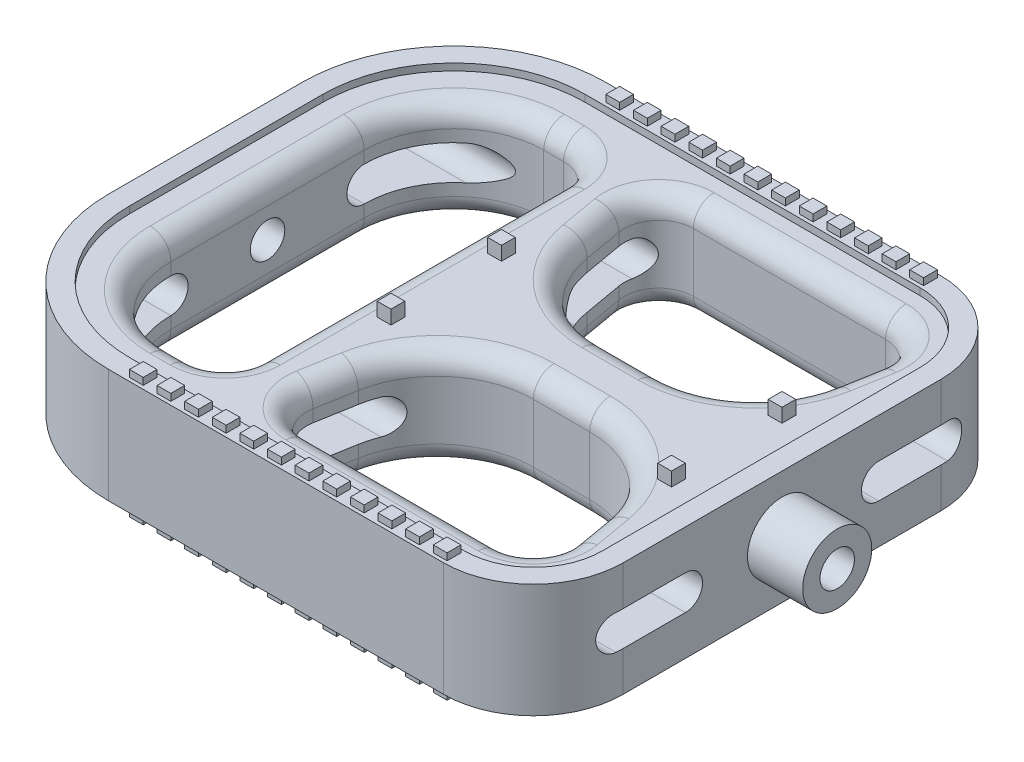
from build123d import *

# Parameters (mm, degrees)
BOSS_EXTRUDE5_DEPTH     = 16.5
BOSS_EXTRUDE1_START     = 1
BOSS_EXTRUDE1_DEPTH     = 14.5
CUT_EXTRUDE1_DEPTH      = 93.41482565
CUT_EXTRUDE1_DEPTH_BACK = 93.41482565
SKETCH2_R               = 2.5
BOSS_EXTRUDE3_START     = 8
SKETCH2_3_R             = 5
SKETCH2_3_R_2           = 2.5
BOSS_EXTRUDE3_DEPTH     = 8
FILLET3_R               = 3
BOSS_EXTRUDE4_START     = -16.5
SKETCH3_W               = 2
SKETCH3_H               = 2
BOSS_EXTRUDE4_DEPTH     = 18.5


with BuildPart() as part:
    # Sketch1<4> → Boss-Extrude5 (new body)
    with BuildSketch(Plane(origin=(0, 0, 0), x_dir=(1, 0, 0), z_dir=(0, 1, 0))):
        with BuildLine():
            Line((-83.5, -14), (-83.5, 14))
            ThreePointArc((-83.5, 14), (-77.056349186, 29.556349186), (-61.5, 36))
            Line((-61.5, 36), (-13, 36))
            ThreePointArc((-13, 36), (-3.807611845, 32.192388155), (0, 23))
            Line((0, 23), (0, -23))
            ThreePointArc((0, -23), (-3.807611845, -32.192388155), (-13, -36))
            Line((-13, -36), (-61.5, -36))
            ThreePointArc((-61.5, -36), (-77.056349186, -29.556349186), (-83.5, -14))
        make_face()
        with BuildLine():
            ThreePointArc((-80.5, -14), (-74.935028843, -27.435028843), (-61.5, -33))
            Line((-61.5, -33), (-13, -33))
            ThreePointArc((-13, -33), (-5.928932188, -30.071067812), (-3, -23))
            Line((-3, -23), (-3, 23))
            ThreePointArc((-3, 23), (-5.928932188, 30.071067812), (-13, 33))
            Line((-13, 33), (-61.5, 33))
            ThreePointArc((-61.5, 33), (-74.935028843, 27.435028843), (-80.5, 14))
            Line((-80.5, 14), (-80.5, -14))
        make_face(mode=Mode.SUBTRACT)
    extrude(amount=BOSS_EXTRUDE5_DEPTH)

    # Sketch1 → Boss-Extrude1 (add)
    # profile 1 of 2: a face of its own
    with BuildSketch(Plane(origin=(0, 0, 0), x_dir=(1, 0, 0), z_dir=(0, 1, 0)).offset(BOSS_EXTRUDE1_START)):
        with BuildLine():
            Line((-3, -23), (-3, 0))
            Line((-3, 0), (-53.625, 0))
            Line((-53.625, 0), (-53.625, -22))
            ThreePointArc((-53.625, -22), (-55.089466094, -25.535533906), (-58.625, -27))
            Line((-58.625, -27), (-61.5, -27))
            ThreePointArc((-61.5, -27), (-70.692388155, -23.192388155), (-74.5, -14))
            Line((-74.5, -14), (-74.5, 0))
            Line((-74.5, 0), (-80.5, 0))
            Line((-80.5, 0), (-80.5, -14))
            ThreePointArc((-80.5, -14), (-74.935028843, -27.435028843), (-61.5, -33))
            Line((-61.5, -33), (-13, -33))
            ThreePointArc((-13, -33), (-5.928932188, -30.071067812), (-3, -23))
        make_face()
        with BuildLine():
            Line((-45.757372098, -22.131759112), (-44.776494446, -16.568925513))
            ThreePointArc((-44.776494446, -16.568925513), (-39.988212439, -8.275377796), (-30.989185904, -5))
            Line((-30.989185904, -5), (-22.84414743, -5))
            ThreePointArc((-22.84414743, -5), (-13.845120894, -8.275377796), (-9.056838888, -16.568925513))
            Line((-9.056838888, -16.568925513), (-8.075961235, -22.131759112))
            ThreePointArc((-8.075961235, -22.131759112), (-9.169777784, -26.213938048), (-13, -28))
            Line((-13, -28), (-40.833333333, -28))
            ThreePointArc((-40.833333333, -28), (-44.663555549, -26.213938048), (-45.757372098, -22.131759112))
        make_face(mode=Mode.SUBTRACT)
    # profile 2 of 2: a face of its own
    with BuildSketch(Plane(origin=(0, 0, 0), x_dir=(1, 0, 0), z_dir=(0, 1, 0)).offset(BOSS_EXTRUDE1_START)):
        with BuildLine():
            Line((-53.625, 0), (-3, 0))
            Line((-3, 0), (-3, 23))
            ThreePointArc((-3, 23), (-5.928932188, 30.071067812), (-13, 33))
            Line((-13, 33), (-61.5, 33))
            ThreePointArc((-61.5, 33), (-74.935028843, 27.435028843), (-80.5, 14))
            Line((-80.5, 14), (-80.5, 0))
            Line((-80.5, 0), (-74.5, 0))
            Line((-74.5, 0), (-74.5, 14))
            ThreePointArc((-74.5, 14), (-70.692388155, 23.192388155), (-61.5, 27))
            Line((-61.5, 27), (-58.625, 27))
            ThreePointArc((-58.625, 27), (-55.089466094, 25.535533906), (-53.625, 22))
            Line((-53.625, 22), (-53.625, 0))
        make_face()
        with BuildLine():
            ThreePointArc((-45.757372098, 22.131759112), (-44.663555549, 26.213938048), (-40.833333333, 28))
            Line((-40.833333333, 28), (-13, 28))
            ThreePointArc((-13, 28), (-9.169777784, 26.213938048), (-8.075961235, 22.131759112))
            Line((-8.075961235, 22.131759112), (-9.056838888, 16.568925513))
            ThreePointArc((-9.056838888, 16.568925513), (-13.845120894, 8.275377796), (-22.84414743, 5))
            Line((-22.84414743, 5), (-30.989185904, 5))
            ThreePointArc((-30.989185904, 5), (-39.988212439, 8.275377796), (-44.776494446, 16.568925513))
            Line((-44.776494446, 16.568925513), (-45.757372098, 22.131759112))
        make_face(mode=Mode.SUBTRACT)
    extrude(amount=BOSS_EXTRUDE1_DEPTH)

    # Sketch2 → Cut-Extrude1 (cut, two sides: drawn at the far end of the back side and taken through both)
    with BuildSketch(Plane(origin=(0, 0, 0), x_dir=(0, 0, -1), z_dir=(1, 0, 0)).offset(-CUT_EXTRUDE1_DEPTH_BACK)):
        with Locations((0, 8.25)):
            Circle(SKETCH2_R)
        with BuildLine():
            Line((14, 5.75), (24, 5.75))
            ThreePointArc((24, 5.75), (26.5, 8.25), (24, 10.75))
            Line((24, 10.75), (14, 10.75))
            ThreePointArc((14, 10.75), (11.5, 8.25), (14, 5.75))
        make_face()
        with BuildLine():
            Line((-14, 10.75), (-24, 10.75))
            ThreePointArc((-24, 10.75), (-26.5, 8.25), (-24, 5.75))
            Line((-24, 5.75), (-14, 5.75))
            ThreePointArc((-14, 5.75), (-11.5, 8.25), (-14, 10.75))
        make_face()
    extrude(amount=CUT_EXTRUDE1_DEPTH + CUT_EXTRUDE1_DEPTH_BACK, mode=Mode.SUBTRACT)

    # Sketch2<3> → Boss-Extrude3 (add)
    with BuildSketch(Plane(origin=(0, 0, 0), x_dir=(0, 0, -1), z_dir=(1, 0, 0)).offset(BOSS_EXTRUDE3_START)):
        with Locations((0, 8.25)):
            Circle(SKETCH2_3_R)
        with Locations((0, 8.25)):
            Circle(SKETCH2_3_R_2, mode=Mode.SUBTRACT)
    extrude(amount=-BOSS_EXTRUDE3_DEPTH)

    # Fillet3
    fillet3_edges = [part.edges().sort_by_distance(p)[0] for p in [
        (-44.663555549, 1, -26.213938048),
        (-45.266933272, 1, -19.350342312),
        (-39.988212439, 1, -8.275377796),
        (-26.916666667, 1, -5),
        (-13.845120894, 1, -8.275377796),
        (-8.566400061, 1, -19.350342312),
        (-9.169777784, 1, -26.213938048),
        (-26.916666667, 1, -28),
        (-60.0625, 15.5, 27),
        (-55.089466094, 15.5, 25.535533906),
        (-53.625, 1, 0),
        (-55.089466094, 1, -25.535533906),
        (-60.0625, 1, -27),
        (-70.692388155, 1, -23.192388155),
        (-74.5, 1, 0),
        (-70.692388155, 15.5, 23.192388155),
        (-26.916666667, 15.5, 5),
        (-39.988212439, 15.5, 8.275377796),
        (-45.266933272, 15.5, 19.350342312),
        (-44.663555549, 15.5, 26.213938048),
        (-26.916666667, 15.5, 28),
        (-9.169777784, 15.5, 26.213938048),
        (-8.566400061, 15.5, 19.350342312),
        (-13.845120894, 15.5, 8.275377796),
        (-13.845120894, 1, 8.275377796),
        (-26.916666667, 1, 5),
        (-39.988212439, 1, 8.275377796),
        (-45.266933272, 1, 19.350342312),
        (-44.663555549, 1, 26.213938048),
        (-26.916666667, 1, 28),
        (-9.169777784, 1, 26.213938048),
        (-8.566400061, 1, 19.350342312),
        (-70.692388155, 1, 23.192388155),
        (-60.0625, 1, 27),
        (-55.089466094, 1, 25.535533906),
        (-74.5, 15.5, 0),
        (-70.692388155, 15.5, -23.192388155),
        (-60.0625, 15.5, -27),
        (-55.089466094, 15.5, -25.535533906),
        (-53.625, 15.5, 0),
        (-44.663555549, 15.5, -26.213938048),
        (-26.916666667, 15.5, -28),
        (-9.169777784, 15.5, -26.213938048),
        (-8.566400061, 15.5, -19.350342312),
        (-13.845120894, 15.5, -8.275377796),
        (-26.916666667, 15.5, -5),
        (-39.988212439, 15.5, -8.275377796),
        (-45.266933272, 15.5, -19.350342312),
    ]]
    fillet(fillet3_edges, radius=FILLET3_R)

    # Sketch3 → Boss-Extrude4 (add)
    with BuildSketch(Plane(origin=(0, 15.5, 0), x_dir=(1, 0, 0), z_dir=(0, 1, 0)).offset(BOSS_EXTRUDE4_START)):
        with Locations((-14, -34.5)):
            Rectangle(SKETCH3_W, SKETCH3_H)
        with Locations((-18, -34.5)):
            Rectangle(SKETCH3_W, SKETCH3_H)
        with Locations((-22, -34.5)):
            Rectangle(SKETCH3_W, SKETCH3_H)
        with Locations((-26, -34.5)):
            Rectangle(SKETCH3_W, SKETCH3_H)
        with Locations((-30, -34.5)):
            Rectangle(SKETCH3_W, SKETCH3_H)
        with Locations((-34, -34.5)):
            Rectangle(SKETCH3_W, SKETCH3_H)
        with Locations((-38, -34.5)):
            Rectangle(SKETCH3_W, SKETCH3_H)
        with Locations((-42, -34.5)):
            Rectangle(SKETCH3_W, SKETCH3_H)
        with Locations((-46, -34.5)):
            Rectangle(SKETCH3_W, SKETCH3_H)
        with Locations((-50, -34.5)):
            Rectangle(SKETCH3_W, SKETCH3_H)
        with Locations((-54, -34.5)):
            Rectangle(SKETCH3_W, SKETCH3_H)
        with Locations((-58, -34.5)):
            Rectangle(SKETCH3_W, SKETCH3_H)
        with Locations((-8, -8)):
            Rectangle(SKETCH3_W, SKETCH3_H)
        with Locations((-48.625, -8)):
            Rectangle(SKETCH3_W, SKETCH3_H)
        with Locations((-48.625, 8)):
            Rectangle(SKETCH3_W, SKETCH3_H)
        with Locations((-8, 8)):
            Rectangle(SKETCH3_W, SKETCH3_H)
        with Locations((-58, 34.5)):
            Rectangle(SKETCH3_W, SKETCH3_H)
        with Locations((-54, 34.5)):
            Rectangle(SKETCH3_W, SKETCH3_H)
        with Locations((-50, 34.5)):
            Rectangle(SKETCH3_W, SKETCH3_H)
        with Locations((-46, 34.5)):
            Rectangle(SKETCH3_W, SKETCH3_H)
        with Locations((-42, 34.5)):
            Rectangle(SKETCH3_W, SKETCH3_H)
        with Locations((-38, 34.5)):
            Rectangle(SKETCH3_W, SKETCH3_H)
        with Locations((-34, 34.5)):
            Rectangle(SKETCH3_W, SKETCH3_H)
        with Locations((-30, 34.5)):
            Rectangle(SKETCH3_W, SKETCH3_H)
        with Locations((-26, 34.5)):
            Rectangle(SKETCH3_W, SKETCH3_H)
        with Locations((-22, 34.5)):
            Rectangle(SKETCH3_W, SKETCH3_H)
        with Locations((-18, 34.5)):
            Rectangle(SKETCH3_W, SKETCH3_H)
        with Locations((-14, 34.5)):
            Rectangle(SKETCH3_W, SKETCH3_H)
    extrude(amount=BOSS_EXTRUDE4_DEPTH)


solid = part.part
